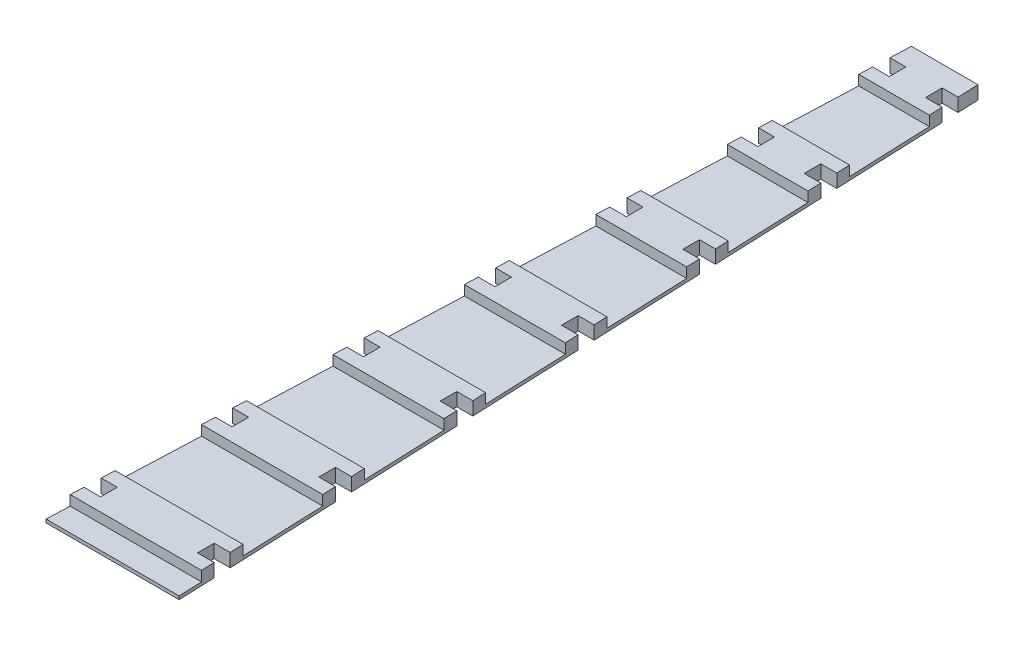
from build123d import *

# Parameters (mm, degrees)
BOSS_EXTRUDE1_DEPTH = 0.5
BOSS_EXTRUDE2_DEPTH = 1.5


with BuildPart() as part:
    # Sketch2 → Boss-Extrude1 (new body)
    with BuildSketch(Plane(origin=(0, 0, 0), x_dir=(1, 0, 0), z_dir=(0, 1, 0))):
        Polygon((0.219191575, 5.479789367), (0, 0), (20, 0), (19.780808425, 5.479789367), (17.280808425, 5.479789367), (17.280808425, 7.979789367), (19.680808425, 7.979789367), (19.021415697, 24.464607583), (16.521415698, 24.464607583), (16.521415698, 26.964607583), (18.921415697, 26.964607583), (18.262022968, 43.449425798), (15.76202297, 43.449425798), (15.76202297, 45.949425798), (18.162022968, 45.949425798), (17.502630239, 62.434244014), (15.002630242, 62.434244014), (15.002630242, 64.934244014), (17.402630239, 64.934244014), (16.743237511, 81.41906223), (14.243237514, 81.41906223), (14.243237514, 83.91906223), (16.643237511, 83.91906223), (15.983844782, 100.403880446), (13.483844787, 100.403880446), (13.483844787, 102.903880446), (15.883844782, 102.903880446), (15.224452054, 119.388698661), (12.724452059, 119.388698661), (12.724452059, 121.888698661), (15.124452054, 121.888698661), (15, 125), (5, 125), (4.875547946, 121.888698661), (7.275547941, 121.888698661), (7.275547941, 119.388698661), (4.775547941, 119.388698661), (4.116155218, 102.903880446), (6.516155213, 102.903880446), (6.516155213, 100.403880446), (4.016155213, 100.403880446), (3.356762489, 83.91906223), (5.756762486, 83.91906223), (5.756762486, 81.41906223), (3.256762486, 81.41906223), (2.597369761, 64.934244014), (4.997369758, 64.934244014), (4.997369758, 62.434244014), (2.497369758, 62.434244014), (1.837977032, 45.949425798), (4.23797703, 45.949425798), (4.23797703, 43.449425798), (1.73797703, 43.449425798), (1.078584303, 26.964607583), (3.478584302, 26.964607583), (3.478584302, 24.464607583), (0.978584302, 24.464607583), (0.319191575, 7.979789367), (2.719191575, 7.979789367), (2.719191575, 5.479789367), align=None)
    extrude(amount=BOSS_EXTRUDE1_DEPTH)

    # Sketch3 → Boss-Extrude2 (add)
    with BuildSketch(Plane(origin=(0, 0.5, 0), x_dir=(1, 0, 0), z_dir=(0, 1, 0))):
        Polygon((0.219191575, 5.479789367), (0.14, 3.5), (19.86, 3.5), (19.780808425, 5.479789367), (17.280808425, 5.479789367), (17.280808425, 7.979789367), (19.680808425, 7.979789367), (19.6, 10), (0.4, 10), (0.319191575, 7.979789367), (2.719191575, 7.979789367), (2.719191575, 5.479789367), align=None)
        Polygon((0.978584302, 24.464607561), (0.898584302, 22.464607561), (19.101415698, 22.464607561), (19.021415697, 24.464607583), (16.521415698, 24.464607583), (16.521415698, 26.964607583), (18.921415697, 26.964607583), (18.841415697, 28.964607583), (1.158584303, 28.964607583), (1.078584303, 26.964607583), (3.478584302, 26.964607583), (3.478584302, 24.464607583), align=None)
        Polygon((1.73797703, 43.449425755), (1.657977032, 41.449425798), (18.342022968, 41.449425798), (18.262022968, 43.449425798), (15.76202297, 43.449425798), (15.76202297, 45.949425798), (18.162022968, 45.949425798), (18.082022968, 47.949425798), (1.917977032, 47.949425798), (1.837977032, 45.949425798), (4.23797703, 45.949425798), (4.23797703, 43.449425798), align=None)
        Polygon((2.497369758, 62.434243949), (2.417369761, 60.434244014), (17.582630239, 60.434244014), (17.502630239, 62.434244014), (15.002630242, 62.434244014), (15.002630242, 64.934244014), (17.402630239, 64.934244014), (17.322630239, 66.934244014), (2.677369761, 66.934244014), (2.597369761, 64.934244014), (4.997369758, 64.934244014), (4.997369758, 62.434244014), align=None)
        Polygon((3.256762486, 81.419062142), (3.176762489, 79.41906223), (16.823237511, 79.41906223), (16.743237511, 81.41906223), (14.243237514, 81.41906223), (14.243237514, 83.91906223), (16.643237511, 83.91906223), (16.563237511, 85.91906223), (3.436762489, 85.91906223), (3.356762489, 83.91906223), (5.756762486, 83.91906223), (5.756762486, 81.41906223), align=None)
        Polygon((4.016155213, 100.403880336), (3.936155218, 98.403880446), (16.063844782, 98.403880446), (15.983844782, 100.403880446), (13.483844787, 100.403880446), (13.483844787, 102.903880446), (15.883844782, 102.903880446), (15.803844782, 104.903880446), (4.196155218, 104.903880446), (4.116155218, 102.903880446), (6.516155213, 102.903880446), (6.516155213, 100.403880446), align=None)
        Polygon((4.775547941, 119.38869853), (4.695547946, 117.388698661), (15.304452054, 117.388698661), (15.224452054, 119.388698661), (12.724452059, 119.388698661), (12.724452059, 121.888698661), (15.124452054, 121.888698661), (15, 125), (5, 125), (4.875547946, 121.888698661), (7.275547941, 121.888698661), (7.275547941, 119.388698661), align=None)
    extrude(amount=BOSS_EXTRUDE2_DEPTH)


solid = part.part
